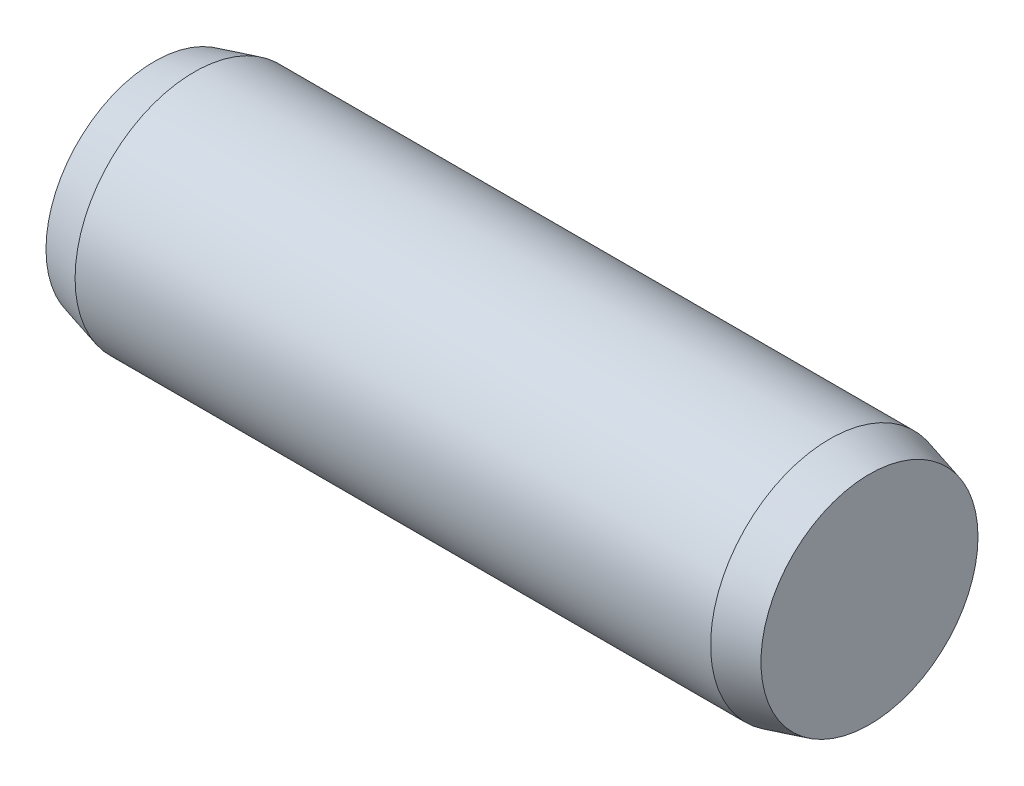
from build123d import *

# Parameters (mm, degrees)
EXTRUDE1_DEPTH      = 4
EXTRUDE1_DEPTH_BACK = 4
SKETCH2_R           = 1.5
SKETCH3_R           = 1.5
EXTRUDE2_DEPTH      = 0.5
EXTRUDE2_TAPER      = 15
SKETCH4_R           = 1.5
EXTRUDE3_DEPTH      = 0.5
EXTRUDE3_TAPER      = 15


with BuildPart() as part:
    # Sketch2 → Extrude1 (new, two sides: drawn at the far end of the back side and taken through both)
    with BuildSketch(Plane(origin=(0, 0, 0), x_dir=(0, 0, -1), z_dir=(1, 0, 0)).offset(-EXTRUDE1_DEPTH_BACK)):
        Circle(SKETCH2_R)
    extrude(amount=EXTRUDE1_DEPTH + EXTRUDE1_DEPTH_BACK)

    # Sketch3 → Extrude2 (add)
    with BuildSketch(Plane(origin=(4, 0, 0), x_dir=(0, 0, -1), z_dir=(1, 0, 0))):
        Circle(SKETCH3_R)
    extrude(amount=EXTRUDE2_DEPTH, taper=EXTRUDE2_TAPER)

    # Sketch4 → Extrude3 (add)
    with BuildSketch(Plane.ZY.offset(4)):
        with Locations(Location((0, 0, 0), (0, 0, 180))):
            Circle(SKETCH4_R)
    extrude(amount=EXTRUDE3_DEPTH, taper=EXTRUDE3_TAPER)


solid = part.part
